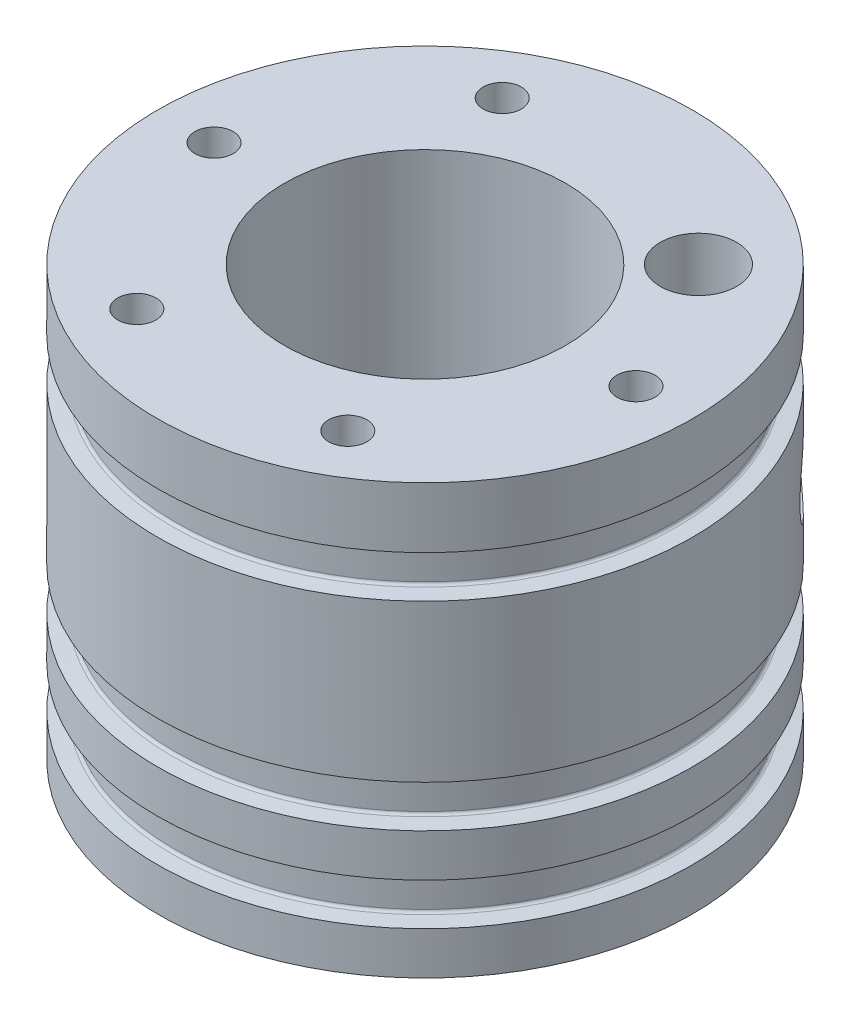
from build123d import *

# Parameters (mm, degrees)
CIRPATTERN1_COUNT            = 6
CUT_EXTRUDE1_REACH           = 72.009
CUT_EXTRUDE1_END_RADIUS      = 12.7
SKETCH15_R                   = 3.175
F_5_16_24_TAPPED_HOLE1_D     = 6.9088
F_5_16_24_TAPPED_HOLE1_DEPTH = 16.509
F_5_16_24_TAPPED_HOLE1_TIP   = 2.075612922


with BuildPart() as part:
    # Sketch1 → Revolve1 (revolve)
    with BuildSketch(Plane.XY, mode=Mode.PRIVATE) as revolve1_sk:
        Polygon((6.8961, 0), (6.8961, 3.81), (12.7, 12.098828216), (12.7, 38.735), (24.1554, 38.735), (24.1554, 0), align=None)
    revolve(revolve1_sk.sketch.rotate(Axis((0, 0, 0), (0, 1, 0)), 90), axis=Axis((0, 0, 0), (0, 1, 0)))

    # Sketch6 → Groove for AS 568-132, O-Ring2 (revolve, cut)
    with BuildSketch(Plane(origin=(0, 0, 0), x_dir=(0, 0, -1), z_dir=(-1, 0, 0)), mode=Mode.PRIVATE) as groove_for_as_568_132_o_ring2_sk:
        with BuildLine():
            Line((22.774362441, -3.977491583), (24.6888, -3.81))
            Line((24.6888, -3.81), (24.6888, -7.700983167))
            Line((24.6888, -7.700983167), (22.774362441, -7.533491583))
            ThreePointArc((22.774362441, -7.533491583), (22.609231556, -7.452058043), (22.5425, -7.28045813))
            Line((22.5425, -7.28045813), (22.5425, -4.230525037))
            ThreePointArc((22.5425, -4.230525037), (22.609231556, -4.058925124), (22.774362441, -3.977491583))
        make_face()
    revolve(groove_for_as_568_132_o_ring2_sk.sketch.rotate(Axis((0, -50, 0), (0, 1, 0)), 180), axis=Axis((0, -50, 0), (0, 1, 0)), mode=Mode.SUBTRACT)

    # Sketch4 → Groove for AS 568-132, O-Ring1 (revolve, cut)
    with BuildSketch(Plane(origin=(0, 0, 0), x_dir=(0, 0, -1), z_dir=(-1, 0, 0))):
        with BuildLine():
            Line((22.774362441, -11.631808297), (24.6888, -11.464316714))
            Line((24.6888, -11.464316714), (24.6888, -15.355299881))
            Line((24.6888, -15.355299881), (22.774362441, -15.187808297))
            ThreePointArc((22.774362441, -15.187808297), (22.609231556, -15.106374757), (22.5425, -14.934774844))
            Line((22.5425, -14.934774844), (22.5425, -11.88484175))
            ThreePointArc((22.5425, -11.88484175), (22.609231556, -11.713241838), (22.774362441, -11.631808297))
        make_face()
    revolve(axis=Axis((0, -50, 0), (0, 1, 0)), mode=Mode.SUBTRACT)

    # Sketch9 → #8-32 Tapped Hole1 (revolve, cut)
    with BuildSketch(Plane(origin=(19.05, 38.735, 0), x_dir=(0, 0, 1), z_dir=(1, 0, 0))):
        Polygon((0, 0), (0, 10.562806461), (1.7272, 9.525), (1.7272, 0), align=None)
    f_8_32_tapped_hole1 = revolve(axis=Axis((19.05, 45.085, 0), (0, -1, 0)), mode=Mode.SUBTRACT)

    # CirPattern1: #8-32 Tapped Hole1 ×6 about axis, 1 skipped
    cirpattern1_axis = Axis((0, 0, 0), (0, -1, 0))
    add([f_8_32_tapped_hole1.rotate(cirpattern1_axis, i * 360 / CIRPATTERN1_COUNT) for i in range(1, CIRPATTERN1_COUNT) if i not in (5,)], mode=Mode.SUBTRACT)

    # Sketch11 → Groove for AS 568-132, O-Ring3 (revolve, cut)
    with BuildSketch(Plane(origin=(0, 0, 0), x_dir=(0, 0, -1), z_dir=(-1, 0, 0)), mode=Mode.PRIVATE) as groove_for_as_568_132_o_ring3_sk:
        with BuildLine():
            Line((22.774362441, -29.592156785), (24.6888, -29.424665202))
            Line((24.6888, -29.424665202), (24.6888, -33.315648369))
            Line((24.6888, -33.315648369), (22.774362441, -33.148156785))
            ThreePointArc((22.774362441, -33.148156785), (22.609231556, -33.066723245), (22.5425, -32.895123332))
            Line((22.5425, -32.895123332), (22.5425, -29.845190239))
            ThreePointArc((22.5425, -29.845190239), (22.609231556, -29.673590326), (22.774362441, -29.592156785))
        make_face()
    revolve(groove_for_as_568_132_o_ring3_sk.sketch.rotate(Axis((0, -50, 0), (0, 1, 0)), 180), axis=Axis((0, -50, 0), (0, 1, 0)), mode=Mode.SUBTRACT)

    # Cut-Extrude1: up to this cylinder (the profile starts outside it)
    cut_extrude1_end = Plane(origin=(0, 22.225, 0), z_dir=(0, -1, 0)) * Cylinder(CUT_EXTRUDE1_END_RADIUS, 170.418, mode=Mode.PRIVATE)
    # Sketch15 → Cut-Extrude1 (cut, up to the surface)
    with BuildSketch(Plane(origin=(17.080447142, 0, -17.080447142), x_dir=(0, -1, 0), z_dir=(0.7071067811865488, 0, -0.7071067811865464)), mode=Mode.PRIVATE) as cut_extrude1_sk1:
        with Locations(Location((-22.225, 0, 0), (0, 0, 90))):
            Circle(SKETCH15_R)
    cut_extrude1_tool1 = extrude(cut_extrude1_sk1.sketch, amount=-CUT_EXTRUDE1_REACH, mode=Mode.PRIVATE) - cut_extrude1_end
    add(cut_extrude1_tool1.solids().sort_by_distance((17.080447, 22.225, -17.080447))[0], mode=Mode.SUBTRACT)

    # 5/16-24 Tapped Hole1
    with Locations(Plane(origin=(0, 38.735, 0), x_dir=(1, 0, 0), z_dir=(0, 1, 0))):
        with Locations((12.347852166, 12.347852166)):
            Hole(F_5_16_24_TAPPED_HOLE1_D / 2, depth=F_5_16_24_TAPPED_HOLE1_DEPTH)
            with Locations((0, 0, -(F_5_16_24_TAPPED_HOLE1_DEPTH + F_5_16_24_TAPPED_HOLE1_TIP / 2))):  # 118° drill point
                Cone(0, F_5_16_24_TAPPED_HOLE1_D / 2, F_5_16_24_TAPPED_HOLE1_TIP, mode=Mode.SUBTRACT)


solid = part.part
